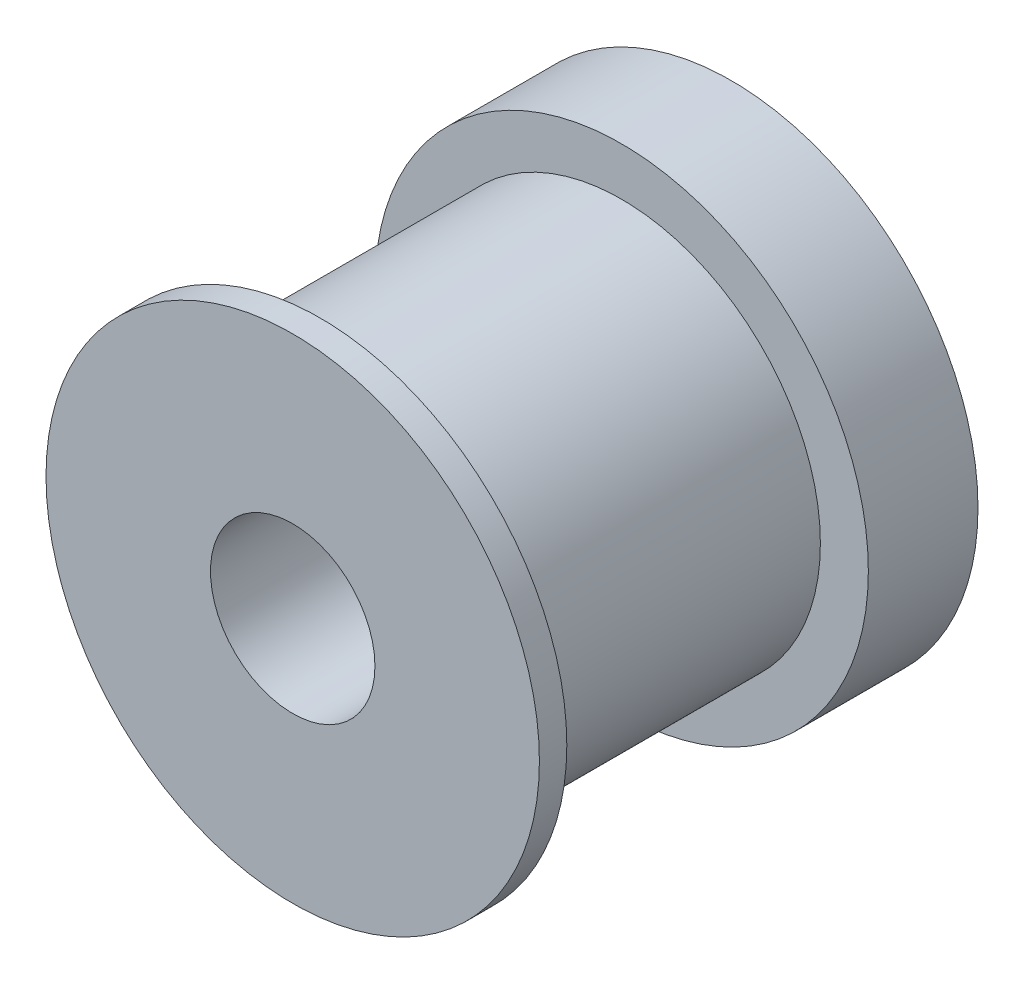
from build123d import *

# Parameters (mm, degrees)
SKETCH1_R           = 9
SKETCH1_R_2         = 3
BOSS_EXTRUDE1_DEPTH = 4
SKETCH2_R           = 7.25
SKETCH2_R_2         = 3
BOSS_EXTRUDE2_DEPTH = 11
SKETCH3_R           = 9
SKETCH3_R_2         = 3
BOSS_EXTRUDE3_DEPTH = 1
ECHELLE1_SCALE      = 2
ECHELLE2_SCALE      = 0.25


with BuildPart() as part:
    # Sketch1 → Boss-Extrude1 (new body)
    with BuildSketch(Plane.XY):
        Circle(SKETCH1_R)
        Circle(SKETCH1_R_2, mode=Mode.SUBTRACT)
    extrude(amount=BOSS_EXTRUDE1_DEPTH)

    # Sketch2 → Boss-Extrude2 (add)
    with BuildSketch(Plane.XY.offset(4)):
        Circle(SKETCH2_R)
        Circle(SKETCH2_R_2, mode=Mode.SUBTRACT)
    extrude(amount=BOSS_EXTRUDE2_DEPTH)

    # Sketch3 → Boss-Extrude3 (add)
    with BuildSketch(Plane.XY.offset(15)):
        Circle(SKETCH3_R)
        Circle(SKETCH3_R_2, mode=Mode.SUBTRACT)
    extrude(amount=BOSS_EXTRUDE3_DEPTH)


with BuildPart() as part_1:
    # Echelle1: scaled about (0, 0, 7.44086542)
    add(part.part.scale(ECHELLE1_SCALE).moved(Location((0, 0, -7.44086542))))


with BuildPart() as part_2:
    # Echelle2: scaled about (0, 0, 7.440865421)
    add(part_1.part.scale(ECHELLE2_SCALE).moved(Location((0, 0, 5.580649066))))


solid = part_2.part
